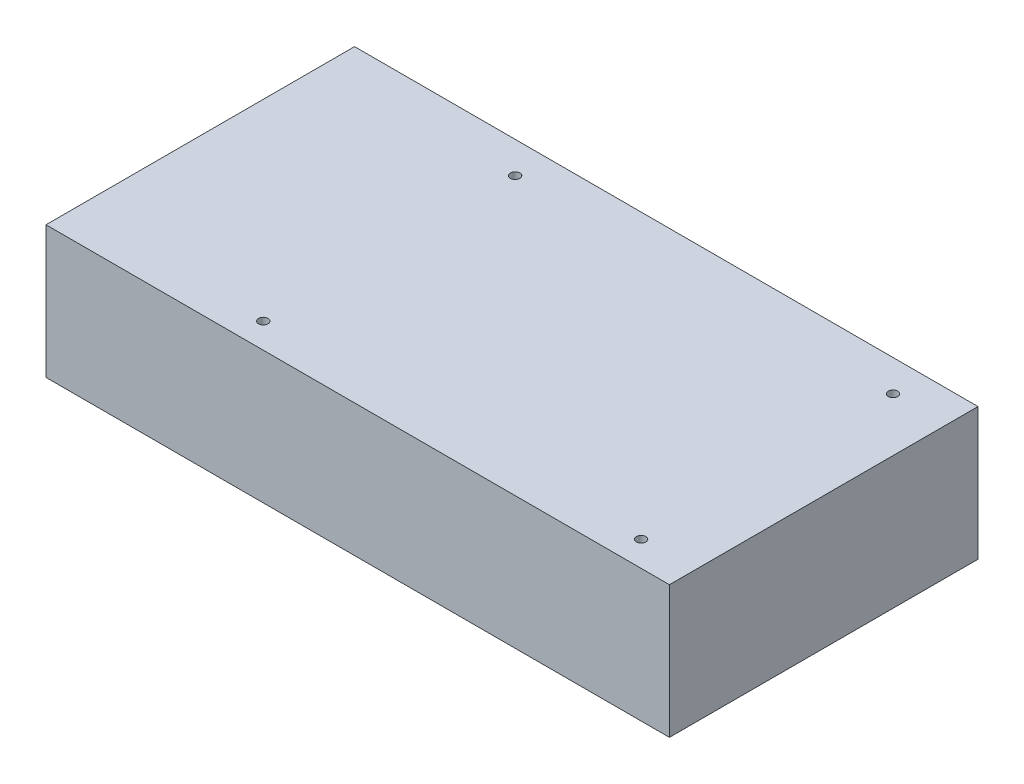
from build123d import *

# Parameters (mm, degrees)
SKETCH_1_W          = 198
SKETCH_1_H          = 98
EXTRUDE_1_DEPTH     = 42
SKETCH_2_R          = 1.5
CUT_EXTRUDE_1_DEPTH = 3
SKETCH_3_R          = 28.5
SKETCH_3_R_2        = 5
CUT_EXTRUDE_2_DEPTH = 2


with BuildPart() as part:
    # 草图1 → 凸台-拉伸1 (new body)
    with BuildSketch(Plane(origin=(0, 0, 0), x_dir=(1, 0, 0), z_dir=(0, 1, 0))):
        with Locations((99, -49)):
            Rectangle(SKETCH_1_W, SKETCH_1_H)
    extrude(amount=EXTRUDE_1_DEPTH)

    # 草图2 → 切除-拉伸1 (cut)
    with BuildSketch(Plane(origin=(0, 42, 0), x_dir=(1, 0, 0), z_dir=(0, 1, 0))):
        with Locations(Location((61, -10, 0), (0, 0, 270))):
            Circle(SKETCH_2_R)
        with Locations(Location((181, -10, 0), (0, 0, 270))):
            Circle(SKETCH_2_R)
        with Locations(Location((181, -90, 0), (0, 0, 270))):
            Circle(SKETCH_2_R)
        with Locations(Location((61, -90, 0), (0, 0, 270))):
            Circle(SKETCH_2_R)
    extrude(amount=-CUT_EXTRUDE_1_DEPTH, mode=Mode.SUBTRACT)

    # 草图3 → 切除-拉伸2 (cut)
    with BuildSketch(Plane.XZ):
        with Locations(Location((153, 35, 0), (0, 0, 270))):
            Circle(SKETCH_3_R)
        with Locations(Location((153, 35, 0), (0, 0, 270))):
            Circle(SKETCH_3_R_2, mode=Mode.SUBTRACT)
    extrude(amount=-CUT_EXTRUDE_2_DEPTH, mode=Mode.SUBTRACT)


solid = part.part
